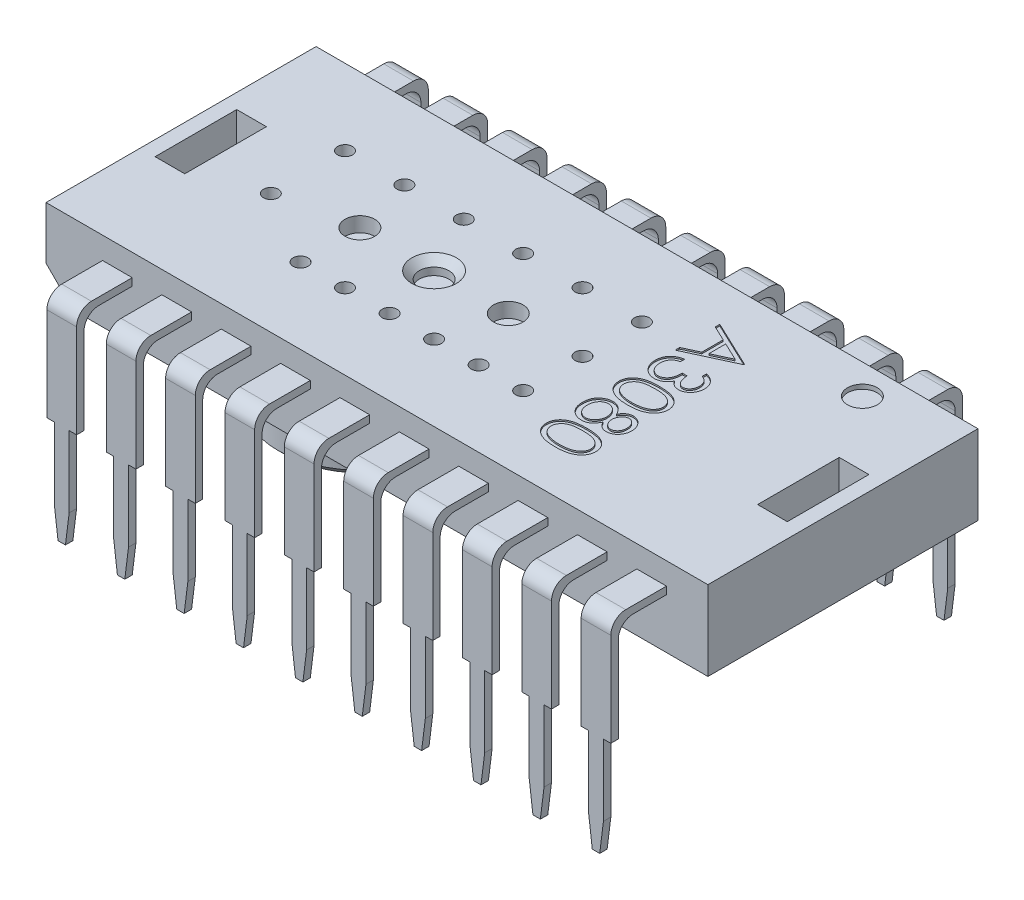
from build123d import *

# Parameters (mm, degrees)
SKETCH1_W           = 22.3
SKETCH1_H           = 9.1
BOSS_EXTRUDE1_DEPTH = 3.18
SKETCH2_R           = 2.8
SKETCH2_R_2         = 0.525
BOSS_EXTRUDE2_DEPTH = 2.25
BOSS_EXTRUDE2_DRAFT = 1.5
CHAMFER1_SIZE       = 0.3
CHAMFER1_SIZE2      = 0.308172622
SKETCH3_W           = 1
SKETCH3_H           = 1.875
BOSS_EXTRUDE3_DEPTH = 0.25
BOSS_EXTRUDE4_DEPTH = 0.25
BOSS_EXTRUDE5_DEPTH = 0.25
FILLET1_R           = 0.5
CUT_EXTRUDE1_DEPTH  = 27.146980705
SKETCH8_W           = 22.3
SKETCH8_H           = 9.1
SKETCH8_W_2         = 19.48
SKETCH8_H_2         = 7.28
CUT_EXTRUDE2_DEPTH  = 0.5
CHAMFER2_SIZE       = 0.91
CUT_EXTRUDE3_DEPTH  = 0.5
SKETCH11_R          = 0.5
CUT_EXTRUDE5_DEPTH  = 0.15
SKETCH13_R          = 0.5
SKETCH13_R_2        = 0.25
CUT_EXTRUDE6_DEPTH  = 0.5
CHAMFER3_SIZE       = 0.25
SKETCH14_W          = 1
SKETCH14_H          = 2.75
CUT_EXTRUDE7_DEPTH  = 1
CUT_EXTRUDE8_DEPTH  = 0.05


with BuildPart() as part:
    # Sketch1 → Boss-Extrude1 (new body)
    with BuildSketch(Plane(origin=(0, 0, 0), x_dir=(1, 0, 0), z_dir=(0, 1, 0))):
        with Locations((11.15, 4.55)):
            Rectangle(SKETCH1_W, SKETCH1_H)
    extrude(amount=BOSS_EXTRUDE1_DEPTH)


with BuildPart() as boss_extrude2_tool:
    # Sketch2 → Boss-Extrude2 (with draft: the straight prism first)
    with BuildSketch(Plane(origin=(0, 0, 0), x_dir=(-1, 0, 0), z_dir=(0, -1, 0))):
        with Locations((-6.025, 4.55)):
            Circle(SKETCH2_R)
        with Locations((-6.025, 4.55)):
            Circle(SKETCH2_R_2, mode=Mode.SUBTRACT)
    extrude(amount=BOSS_EXTRUDE2_DEPTH)
    # Boss-Extrude2: the draft: its side faces are tilted about the plane it starts from
    boss_extrude2_sides = [boss_extrude2_tool.faces().sort_by_distance(p)[0] for p in [
        (8.825, -1.125, -4.55),
        (6.55, -1.125, -4.55),
    ]]
    draft(boss_extrude2_sides, Plane(origin=(0, 0, 0), x_dir=(-1, 0, 0), z_dir=(0, -1, 0)), BOSS_EXTRUDE2_DRAFT)


with BuildPart() as part_1:
    add(part.part)

    # Boss-Extrude2: add boss_extrude2_tool
    add(boss_extrude2_tool.part)

    # Chamfer1
    chamfer1_edges = [part_1.edges().sort_by_distance(p)[0] for p in [
        (8.766081676, -2.25, -4.55),
    ]]
    chamfer1_side = [part_1.faces().sort_by_distance(p)[0] for p in [
        (8.795540838, -1.125, -4.55),
    ]]
    chamfer(chamfer1_edges, length=CHAMFER1_SIZE, length2=CHAMFER1_SIZE2, reference=chamfer1_side[0])

    # Sketch3 → Boss-Extrude3 (add)
    with BuildSketch(Plane(origin=(0, 2.19, 0), x_dir=(1, 0, 0), z_dir=(0, 1, 0))):
        with Locations((19.405, 10.0375)):
            Rectangle(SKETCH3_W, SKETCH3_H)
        with Locations((17.405, 10.0375)):
            Rectangle(SKETCH3_W, SKETCH3_H)
        with Locations((15.405, 10.0375)):
            Rectangle(SKETCH3_W, SKETCH3_H)
        with Locations((13.405, 10.0375)):
            Rectangle(SKETCH3_W, SKETCH3_H)
        with Locations((11.405, 10.0375)):
            Rectangle(SKETCH3_W, SKETCH3_H)
        with Locations((9.405, 10.0375)):
            Rectangle(SKETCH3_W, SKETCH3_H)
        with Locations((7.405, 10.0375)):
            Rectangle(SKETCH3_W, SKETCH3_H)
        with Locations((5.405, 10.0375)):
            Rectangle(SKETCH3_W, SKETCH3_H)
        with Locations((3.405, 10.0375)):
            Rectangle(SKETCH3_W, SKETCH3_H)
        with Locations((1.405, 10.0375)):
            Rectangle(SKETCH3_W, SKETCH3_H)
        with Locations((20.405, -0.9375)):
            Rectangle(SKETCH3_W, SKETCH3_H)
        with Locations((18.405, -0.9375)):
            Rectangle(SKETCH3_W, SKETCH3_H)
        with Locations((16.405, -0.9375)):
            Rectangle(SKETCH3_W, SKETCH3_H)
        with Locations((14.405, -0.9375)):
            Rectangle(SKETCH3_W, SKETCH3_H)
        with Locations((12.405, -0.9375)):
            Rectangle(SKETCH3_W, SKETCH3_H)
        with Locations((10.405, -0.9375)):
            Rectangle(SKETCH3_W, SKETCH3_H)
        with Locations((8.405, -0.9375)):
            Rectangle(SKETCH3_W, SKETCH3_H)
        with Locations((6.405, -0.9375)):
            Rectangle(SKETCH3_W, SKETCH3_H)
        with Locations((4.405, -0.9375)):
            Rectangle(SKETCH3_W, SKETCH3_H)
        with Locations((2.405, -0.9375)):
            Rectangle(SKETCH3_W, SKETCH3_H)
    extrude(amount=BOSS_EXTRUDE3_DEPTH)

    # Sketch5 → Boss-Extrude4 (add)
    with BuildSketch(Plane.XY.offset(1.875)):
        Polygon((1.905, 2.19), (2.905, 2.19), (2.905, -1.21), (2.655, -1.21), (2.655, -4.61), (2.155, -4.61), (2.155, -1.21), (1.905, -1.21), align=None)
        Polygon((3.905, 2.19), (4.905, 2.19), (4.905, -1.21), (4.655, -1.21), (4.655, -4.61), (4.155, -4.61), (4.155, -1.21), (3.905, -1.21), align=None)
        Polygon((5.905, 2.19), (6.905, 2.19), (6.905, -1.21), (6.655, -1.21), (6.655, -4.61), (6.155, -4.61), (6.155, -1.21), (5.905, -1.21), align=None)
        Polygon((7.905, 2.19), (8.905, 2.19), (8.905, -1.21), (8.655, -1.21), (8.655, -4.61), (8.155, -4.61), (8.155, -1.21), (7.905, -1.21), align=None)
        Polygon((9.905, 2.19), (10.905, 2.19), (10.905, -1.21), (10.655, -1.21), (10.655, -4.61), (10.155, -4.61), (10.155, -1.21), (9.905, -1.21), align=None)
        Polygon((11.905, 2.19), (12.905, 2.19), (12.905, -1.21), (12.655, -1.21), (12.655, -4.61), (12.155, -4.61), (12.155, -1.21), (11.905, -1.21), align=None)
        Polygon((13.905, 2.19), (14.905, 2.19), (14.905, -1.21), (14.655, -1.21), (14.655, -4.61), (14.155, -4.61), (14.155, -1.21), (13.905, -1.21), align=None)
        Polygon((15.905, 2.19), (16.905, 2.19), (16.905, -1.21), (16.655, -1.21), (16.655, -4.61), (16.155, -4.61), (16.155, -1.21), (15.905, -1.21), align=None)
        Polygon((17.905, 2.19), (18.905, 2.19), (18.905, -1.21), (18.655, -1.21), (18.655, -4.61), (18.155, -4.61), (18.155, -1.21), (17.905, -1.21), align=None)
        Polygon((19.905, 2.19), (20.905, 2.19), (20.905, -1.21), (20.655, -1.21), (20.655, -4.61), (20.155, -4.61), (20.155, -1.21), (19.905, -1.21), align=None)
    extrude(amount=-BOSS_EXTRUDE4_DEPTH)

    # Sketch6 → Boss-Extrude5 (add)
    with BuildSketch(Plane(origin=(0, 0, -10.975), x_dir=(-1, 0, 0), z_dir=(0, 0, -1))):
        Polygon((-19.905, 2.19), (-19.905, -1.21), (-19.655, -1.21), (-19.655, -4.61), (-19.155, -4.61), (-19.155, -1.21), (-18.905, -1.21), (-18.905, 2.19), align=None)
        Polygon((-17.905, 2.19), (-17.905, -1.21), (-17.655, -1.21), (-17.655, -4.61), (-17.155, -4.61), (-17.155, -1.21), (-16.905, -1.21), (-16.905, 2.19), align=None)
        Polygon((-15.905, 2.19), (-15.905, -1.21), (-15.655, -1.21), (-15.655, -4.61), (-15.155, -4.61), (-15.155, -1.21), (-14.905, -1.21), (-14.905, 2.19), align=None)
        Polygon((-13.905, 2.19), (-13.905, -1.21), (-13.655, -1.21), (-13.655, -4.61), (-13.155, -4.61), (-13.155, -1.21), (-12.905, -1.21), (-12.905, 2.19), align=None)
        Polygon((-11.905, 2.19), (-11.905, -1.21), (-11.655, -1.21), (-11.655, -4.61), (-11.155, -4.61), (-11.155, -1.21), (-10.905, -1.21), (-10.905, 2.19), align=None)
        Polygon((-9.905, 2.19), (-9.905, -1.21), (-9.655, -1.21), (-9.655, -4.61), (-9.155, -4.61), (-9.155, -1.21), (-8.905, -1.21), (-8.905, 2.19), align=None)
        Polygon((-7.905, 2.19), (-7.905, -1.21), (-7.655, -1.21), (-7.655, -4.61), (-7.155, -4.61), (-7.155, -1.21), (-6.905, -1.21), (-6.905, 2.19), align=None)
        Polygon((-5.905, 2.19), (-5.905, -1.21), (-5.655, -1.21), (-5.655, -4.61), (-5.155, -4.61), (-5.155, -1.21), (-4.905, -1.21), (-4.905, 2.19), align=None)
        Polygon((-3.905, 2.19), (-3.905, -1.21), (-3.655, -1.21), (-3.655, -4.61), (-3.155, -4.61), (-3.155, -1.21), (-2.905, -1.21), (-2.905, 2.19), align=None)
        Polygon((-1.905, 2.19), (-1.905, -1.21), (-1.655, -1.21), (-1.655, -4.61), (-1.155, -4.61), (-1.155, -1.21), (-0.905, -1.21), (-0.905, 2.19), align=None)
    extrude(amount=-BOSS_EXTRUDE5_DEPTH)

    # Fillet1
    fillet1_edges = [part_1.edges().sort_by_distance(p)[0] for p in [
        (7.405, 2.44, -10.975),
        (5.405, 2.44, -10.975),
        (3.405, 2.44, -10.975),
        (1.405, 2.44, -10.975),
        (18.405, 2.44, 1.875),
        (16.405, 2.44, 1.875),
        (14.405, 2.44, 1.875),
        (12.405, 2.44, 1.875),
        (10.405, 2.44, 1.875),
        (8.405, 2.44, 1.875),
        (6.405, 2.44, 1.875),
        (4.405, 2.44, 1.875),
        (2.405, 2.44, 1.875),
        (2.405, 2.19, 1.625),
        (4.405, 2.19, 1.625),
        (6.405, 2.19, 1.625),
        (19.405, 2.44, -10.975),
        (8.405, 2.19, 1.625),
        (10.405, 2.19, 1.625),
        (12.405, 2.19, 1.625),
        (14.405, 2.19, 1.625),
        (16.405, 2.19, 1.625),
        (18.405, 2.19, 1.625),
        (20.405, 2.44, 1.875),
        (20.405, 2.19, 1.625),
        (19.405, 2.19, -10.725),
        (17.405, 2.19, -10.725),
        (17.405, 2.44, -10.975),
        (15.405, 2.19, -10.725),
        (13.405, 2.19, -10.725),
        (11.405, 2.19, -10.725),
        (9.405, 2.19, -10.725),
        (7.405, 2.19, -10.725),
        (5.405, 2.19, -10.725),
        (15.405, 2.44, -10.975),
        (3.405, 2.19, -10.725),
        (1.405, 2.19, -10.725),
        (13.405, 2.44, -10.975),
        (11.405, 2.44, -10.975),
        (9.405, 2.44, -10.975),
    ]]
    fillet(fillet1_edges, radius=FILLET1_R)

    # Sketch7 → Cut-Extrude1 (cut, through all)
    with BuildSketch(Plane.XY.offset(-10.975)):
        Polygon((1.53, -4.61), (1.655, -3.61), (1.655, -4.61), align=None)
        Polygon((1.28, -4.61), (1.155, -3.61), (1.155, -4.61), align=None)
        Polygon((2.53, -4.61), (2.655, -3.61), (2.655, -4.61), align=None)
        Polygon((2.28, -4.61), (2.155, -3.61), (2.155, -4.61), align=None)
        Polygon((3.53, -4.61), (3.655, -3.61), (3.655, -4.61), align=None)
        Polygon((3.28, -4.61), (3.155, -3.61), (3.155, -4.61), align=None)
        Polygon((4.53, -4.61), (4.655, -3.61), (4.655, -4.61), align=None)
        Polygon((4.28, -4.61), (4.155, -3.61), (4.155, -4.61), align=None)
        Polygon((5.53, -4.61), (5.655, -3.61), (5.655, -4.61), align=None)
        Polygon((5.28, -4.61), (5.155, -3.61), (5.155, -4.61), align=None)
        Polygon((6.53, -4.61), (6.655, -3.61), (6.655, -4.61), align=None)
        Polygon((6.28, -4.61), (6.155, -3.61), (6.155, -4.61), align=None)
        Polygon((7.53, -4.61), (7.655, -3.61), (7.655, -4.61), align=None)
        Polygon((7.28, -4.61), (7.155, -3.61), (7.155, -4.61), align=None)
        Polygon((8.53, -4.61), (8.655, -3.61), (8.655, -4.61), align=None)
        Polygon((8.28, -4.61), (8.155, -3.61), (8.155, -4.61), align=None)
        Polygon((9.53, -4.61), (9.655, -3.61), (9.655, -4.61), align=None)
        Polygon((9.28, -4.61), (9.155, -3.61), (9.155, -4.61), align=None)
        Polygon((10.53, -4.61), (10.655, -3.61), (10.655, -4.61), align=None)
        Polygon((10.28, -4.61), (10.155, -3.61), (10.155, -4.61), align=None)
        Polygon((11.53, -4.61), (11.655, -3.61), (11.655, -4.61), align=None)
        Polygon((11.28, -4.61), (11.155, -3.61), (11.155, -4.61), align=None)
        Polygon((12.53, -4.61), (12.655, -3.61), (12.655, -4.61), align=None)
        Polygon((12.28, -4.61), (12.155, -3.61), (12.155, -4.61), align=None)
        Polygon((13.53, -4.61), (13.655, -3.61), (13.655, -4.61), align=None)
        Polygon((13.28, -4.61), (13.155, -3.61), (13.155, -4.61), align=None)
        Polygon((14.53, -4.61), (14.655, -3.61), (14.655, -4.61), align=None)
        Polygon((14.28, -4.61), (14.155, -3.61), (14.155, -4.61), align=None)
        Polygon((15.53, -4.61), (15.655, -3.61), (15.655, -4.61), align=None)
        Polygon((15.28, -4.61), (15.155, -3.61), (15.155, -4.61), align=None)
        Polygon((16.53, -4.61), (16.655, -3.61), (16.655, -4.61), align=None)
        Polygon((16.28, -4.61), (16.155, -3.61), (16.155, -4.61), align=None)
        Polygon((17.53, -4.61), (17.655, -3.61), (17.655, -4.61), align=None)
        Polygon((17.28, -4.61), (17.155, -3.61), (17.155, -4.61), align=None)
        Polygon((18.53, -4.61), (18.655, -3.61), (18.655, -4.61), align=None)
        Polygon((18.28, -4.61), (18.155, -3.61), (18.155, -4.61), align=None)
        Polygon((19.53, -4.61), (19.655, -3.61), (19.655, -4.61), align=None)
        Polygon((19.28, -4.61), (19.155, -3.61), (19.155, -4.61), align=None)
        Polygon((20.53, -4.61), (20.655, -3.61), (20.655, -4.61), align=None)
        Polygon((20.28, -4.61), (20.155, -3.61), (20.155, -4.61), align=None)
    extrude(amount=CUT_EXTRUDE1_DEPTH, mode=Mode.SUBTRACT)

    # Sketch8 → Cut-Extrude2 (cut)
    with BuildSketch(Plane(origin=(0, 0, 0), x_dir=(-1, 0, 0), z_dir=(0, -1, 0))):
        with Locations((-11.15, 4.55)):
            Rectangle(SKETCH8_W, SKETCH8_H)
        with Locations((-11.15, 4.55)):
            Rectangle(SKETCH8_W_2, SKETCH8_H_2, mode=Mode.SUBTRACT)
    extrude(amount=-CUT_EXTRUDE2_DEPTH, mode=Mode.SUBTRACT)

    # Chamfer2
    chamfer2_edges = [part_1.edges().sort_by_distance(p)[0] for p in [
        (0, 0.5, -4.55),
    ]]
    chamfer(chamfer2_edges, length=CHAMFER2_SIZE)

    # Sketch9 → Cut-Extrude3 (cut)
    with BuildSketch(Plane(origin=(0, 0, 0), x_dir=(-1, 0, 0), z_dir=(0, -1, 0))):
        with BuildLine():
            Line((-1.41, 3.05), (-1.41, 6.05))
            ThreePointArc((-1.41, 6.05), (-2.117106781, 5.757106781), (-2.41, 5.05))
            Line((-2.41, 5.05), (-2.41, 4.05))
            ThreePointArc((-2.41, 4.05), (-2.117106781, 3.342893219), (-1.41, 3.05))
        make_face()
    extrude(amount=-CUT_EXTRUDE3_DEPTH, mode=Mode.SUBTRACT)

    # Sketch11 → Cut-Extrude5 (cut)
    with BuildSketch(Plane(origin=(0, 3.18, 0), x_dir=(1, 0, 0), z_dir=(0, 1, 0))):
        with Locations(Location((19.405, 8.1, 0), (0, 0, 270))):
            Circle(SKETCH11_R)
    extrude(amount=-CUT_EXTRUDE5_DEPTH, mode=Mode.SUBTRACT)

    # Sketch13 → Cut-Extrude6 (cut)
    with BuildSketch(Plane(origin=(0, 3.18, 0), x_dir=(1, 0, 0), z_dir=(0, 1, 0))):
        with Locations(Location((6.025, 4.55, 0), (0, 0, 270))):
            Circle(SKETCH13_R)
        with Locations(Location((8.525, 4.55, 0), (0, 0, 270))):
            Circle(SKETCH13_R)
        with Locations(Location((11.025, 4.55, 0), (0, 0, 270))):
            Circle(SKETCH13_R)
        with Locations(Location((3.525, 6.55, 0), (0, 0, 270))):
            Circle(SKETCH13_R_2)
        with Locations(Location((5.525, 6.55, 0), (0, 0, 270))):
            Circle(SKETCH13_R_2)
        with Locations(Location((7.525, 6.55, 0), (0, 0, 270))):
            Circle(SKETCH13_R_2)
        with Locations(Location((9.525, 6.55, 0), (0, 0, 270))):
            Circle(SKETCH13_R_2)
        with Locations(Location((11.525, 6.55, 0), (0, 0, 270))):
            Circle(SKETCH13_R_2)
        with Locations(Location((13.525, 6.55, 0), (0, 0, 270))):
            Circle(SKETCH13_R_2)
        with Locations(Location((13.525, 4.55, 0), (0, 0, 270))):
            Circle(SKETCH13_R_2)
        with Locations(Location((13.525, 2.55, 0), (0, 0, 270))):
            Circle(SKETCH13_R_2)
        with Locations(Location((12.025, 2.55, 0), (0, 0, 270))):
            Circle(SKETCH13_R_2)
        with Locations(Location((10.525, 2.55, 0), (0, 0, 270))):
            Circle(SKETCH13_R_2)
        with Locations(Location((9.025, 2.55, 0), (0, 0, 270))):
            Circle(SKETCH13_R_2)
        with Locations(Location((7.525, 2.55, 0), (0, 0, 270))):
            Circle(SKETCH13_R_2)
        with Locations(Location((6.025, 2.55, 0), (0, 0, 270))):
            Circle(SKETCH13_R_2)
        with Locations(Location((3.525, 4.05, 0), (0, 0, 270))):
            Circle(SKETCH13_R_2)
    extrude(amount=-CUT_EXTRUDE6_DEPTH, mode=Mode.SUBTRACT)

    # Chamfer3
    chamfer3_edges = [part_1.edges().sort_by_distance(p)[0] for p in [
        (8.525, 3.18, -5.05),
    ]]
    chamfer(chamfer3_edges, length=CHAMFER3_SIZE)

    # Sketch14 → Cut-Extrude7 (cut)
    with BuildSketch(Plane(origin=(0, 3.18, 0), x_dir=(1, 0, 0), z_dir=(0, 1, 0))):
        with Locations((1, 4.55)):
            Rectangle(SKETCH14_W, SKETCH14_H)
        with Locations((21.3, 4.55)):
            Rectangle(SKETCH14_W, SKETCH14_H)
    extrude(amount=-CUT_EXTRUDE7_DEPTH, mode=Mode.SUBTRACT)

    # Sketch15 → Cut-Extrude8 (cut)
    # profile 1 of 5: a face of its own
    with BuildSketch(Plane(origin=(0, 3.18, 0), x_dir=(1, 0, 0), z_dir=(0, 1, 0))):
        Polygon((16.4925, 7.024038462), (14.905, 6.291346154), (14.905, 6.446216446), (15.413814103, 6.680906951), (15.413814103, 7.400560897), (14.905, 7.641929587), (14.905, 7.797435897), (16.4925, 7.044391026), align=None)
        Polygon((16.183077424, 7.035804788), (15.576634615, 7.323284756), (15.576634615, 6.755957031), align=None, mode=Mode.SUBTRACT)
    # profile 2 of 5: a face of its own
    with BuildSketch(Plane(origin=(0, 3.18, 0), x_dir=(1, 0, 0), z_dir=(0, 1, 0))):
        with BuildLine():
            Line((16.126153846, 5.986057692), (16.126153846, 6.128525641))
            add(Edge.make_bspline(
                [(16.126153846, 6.128525641), (16.142134294, 6.124665952), (16.173374763, 6.117120576), (16.218009485, 6.101382748), (16.260247654, 6.084238085), (16.299298373, 6.063650884), (16.335946447, 6.041195128), (16.369360657, 6.015467322), (16.400390823, 5.987654448), (16.427928613, 5.956890989), (16.45286494, 5.92462906), (16.474126127, 5.890414072), (16.49241601, 5.854934402), (16.507483759, 5.817944231), (16.518834621, 5.779333432), (16.527070029, 5.739451067), (16.532418142, 5.698192622), (16.532940095, 5.67018568), (16.533205128, 5.655964543)],
                knots=[0, 0, 0, 0, 1.162005537, 2.271625781, 3.343758855, 4.383309926, 5.390229558, 6.379919256, 7.361854164, 8.333198761, 9.295911338, 10.242430842, 11.177959212, 12.116337295, 13.062827104, 14.020064771, 14.994644689, 16, 16, 16, 16], degree=3))
            add(Edge.make_bspline(
                [(16.533205128, 5.655964543), (16.532579549, 5.635244157), (16.531342036, 5.594255355), (16.520041559, 5.53403783), (16.502159445, 5.475968523), (16.477451719, 5.420683043), (16.446977474, 5.369330397), (16.410707754, 5.323639341), (16.369342356, 5.284229195), (16.323652943, 5.251166388), (16.27482348, 5.225278799), (16.224567694, 5.206189622), (16.1730048, 5.19456836), (16.138189891, 5.19306225), (16.120747696, 5.192307692)],
                knots=[0, 0, 0, 0, 1.083050992, 2.142477498, 3.193116406, 4.255571735, 5.30263384, 6.308962982, 7.297363603, 8.282367274, 9.249857812, 10.179914175, 11.08814088, 12, 12, 12, 12], degree=3))
            add(Edge.make_bspline(
                [(16.120747696, 5.192307692), (16.103962472, 5.192835464), (16.071116392, 5.193868231), (16.023164141, 5.202637448), (15.977969558, 5.217394967), (15.935342388, 5.237837323), (15.895552907, 5.264299384), (15.858511592, 5.2963545), (15.824054153, 5.334228921), (15.804314963, 5.36293044), (15.794152644, 5.377706831)],
                knots=[0, 0, 0, 0, 1.024540389, 2.004866551, 2.965041327, 3.920577974, 4.882998113, 5.874504559, 6.905732034, 8, 8, 8, 8], degree=3))
            add(Edge.make_bspline(
                [(15.794152644, 5.377706831), (15.785998259, 5.360819571), (15.769842064, 5.327361024), (15.738157488, 5.281754177), (15.701574074, 5.240353141), (15.673025085, 5.217264668), (15.658680889, 5.205664062)],
                knots=[0, 0, 0, 0, 1.015518401, 2.012035669, 3.001164323, 4, 4, 4, 4], degree=3))
            add(Edge.make_bspline(
                [(15.658680889, 5.205664062), (15.648223667, 5.198022201), (15.627480465, 5.18286362), (15.594110161, 5.164205787), (15.560480456, 5.147085967), (15.525269074, 5.134486276), (15.489607067, 5.123613241), (15.452730768, 5.116459146), (15.414990535, 5.111866504), (15.389446887, 5.111221603), (15.376607071, 5.110897436)],
                knots=[0, 0, 0, 0, 1.02516404, 2.033540309, 3.025129118, 4.011046665, 4.991655828, 5.976607087, 6.982917762, 8, 8, 8, 8], degree=3))
            add(Edge.make_bspline(
                [(15.376607071, 5.110897436), (15.354378546, 5.111713168), (15.310026103, 5.113340794), (15.244483238, 5.127830044), (15.180524796, 5.150421867), (15.119098432, 5.181943207), (15.061745877, 5.220943386), (15.010663742, 5.267599106), (14.966459163, 5.320776176), (14.929644291, 5.380126562), (14.900193981, 5.444399758), (14.87975868, 5.513151651), (14.866447773, 5.585382508), (14.865020499, 5.634915875), (14.864294872, 5.660098658)],
                knots=[0, 0, 0, 0, 0.95570045, 1.906903359, 2.87519758, 3.868912786, 4.869932978, 5.851730567, 6.836639976, 7.83677598, 8.849487602, 9.869908895, 10.917060885, 12, 12, 12, 12], degree=3))
            add(Edge.make_bspline(
                [(14.864294872, 5.660098658), (14.864688669, 5.677070983), (14.865463529, 5.71046686), (14.870760609, 5.759563018), (14.88043529, 5.806426789), (14.893454289, 5.851121535), (14.909960544, 5.893686963), (14.93051581, 5.933993182), (14.954696384, 5.972288169), (14.98278769, 6.008210551), (15.014211726, 6.041756044), (15.049526349, 6.072033172), (15.088078743, 6.099546721), (15.1303167, 6.12355999), (15.175694371, 6.14516675), (15.224792797, 6.162938113), (15.27717305, 6.178579781), (15.313675453, 6.185852103), (15.332403846, 6.189583333)],
                knots=[0, 0, 0, 0, 1.048658725, 2.063410685, 3.046034179, 4.001477787, 4.936774919, 5.862367409, 6.792675028, 7.730719943, 8.675894397, 9.627829632, 10.600096036, 11.597688215, 12.626045268, 13.701542398, 14.82072376, 16, 16, 16, 16], degree=3))
            Line((15.332403846, 6.189583333), (15.332403846, 6.047115385))
            add(Edge.make_bspline(
                [(15.332403846, 6.047115385), (15.320180544, 6.043403677), (15.296405159, 6.036184085), (15.262187592, 6.023894885), (15.230819475, 6.009893919), (15.202070701, 5.994874101), (15.175658147, 5.979099592), (15.152280228, 5.961448894), (15.130910119, 5.943229317), (15.118870241, 5.929495467), (15.112977764, 5.922773938)],
                knots=[0, 0, 0, 0, 1.198163088, 2.33053128, 3.407730985, 4.417276592, 5.372219308, 6.28897303, 7.162600585, 8, 8, 8, 8], degree=3))
            add(Edge.make_bspline(
                [(15.112977764, 5.922773938), (15.106125056, 5.913885491), (15.092440791, 5.896136033), (15.074977553, 5.867212586), (15.059845945, 5.836793869), (15.048287269, 5.804220785), (15.038500258, 5.770196228), (15.032095594, 5.734170245), (15.027701316, 5.696460671), (15.027313544, 5.670712436), (15.027115385, 5.657554587)],
                knots=[0, 0, 0, 0, 0.946170439, 1.889420265, 2.845303464, 3.807233317, 4.801018734, 5.828864929, 6.890507805, 8, 8, 8, 8], degree=3))
            add(Edge.make_bspline(
                [(15.027115385, 5.657554587), (15.027394287, 5.642698333), (15.027939657, 5.613648211), (15.032969629, 5.571262566), (15.040263244, 5.53092665), (15.051671877, 5.493052089), (15.065358417, 5.457123504), (15.083276609, 5.423942925), (15.10351231, 5.392534884), (15.127050322, 5.36381949), (15.152492366, 5.337931159), (15.179484107, 5.315560781), (15.207188626, 5.296185475), (15.236252213, 5.280610962), (15.266389777, 5.268290792), (15.297714125, 5.259908797), (15.329961484, 5.254079329), (15.351882168, 5.253604668), (15.362932692, 5.253365385)],
                knots=[0, 0, 0, 0, 1.216990249, 2.379719373, 3.493992396, 4.571561497, 5.616923107, 6.638958652, 7.655775068, 8.674704564, 9.676001865, 10.625896028, 11.54399481, 12.441854662, 13.322657739, 14.20572845, 15.095482574, 16, 16, 16, 16], degree=3))
            add(Edge.make_bspline(
                [(15.362932692, 5.253365385), (15.377724281, 5.254059473), (15.407233856, 5.255444197), (15.450648363, 5.266016487), (15.492479244, 5.283405181), (15.532006794, 5.307752319), (15.568659066, 5.337375952), (15.601233951, 5.371989323), (15.62838324, 5.411677338), (15.647071792, 5.448440517), (15.659526925, 5.481082693), (15.668260232, 5.508961706), (15.675241483, 5.54020072), (15.681994455, 5.574424717), (15.687655718, 5.611778038), (15.692397247, 5.652294335), (15.696185256, 5.695989908), (15.697877803, 5.726239054), (15.69875, 5.741826923)],
                knots=[0, 0, 0, 0, 1.070481957, 2.135637345, 3.216366529, 4.339485895, 5.485746587, 6.620975969, 7.768829582, 8.956804399, 9.598399438, 10.297751078, 11.070570279, 11.915248466, 12.824061284, 13.805856426, 14.869322739, 16, 16, 16, 16], degree=3))
            Line((15.69875, 5.741826923), (15.861570513, 5.741826923))
            add(Edge.make_bspline(
                [(15.861570513, 5.741826923), (15.861905252, 5.722187294), (15.862560924, 5.683718086), (15.870436244, 5.627515528), (15.88145278, 5.573708221), (15.897937562, 5.523524379), (15.917724005, 5.477932735), (15.940034664, 5.438161166), (15.965311641, 5.405152242), (15.993223197, 5.378823493), (16.023508241, 5.359499126), (16.054742756, 5.344994274), (16.087653465, 5.336490943), (16.110100708, 5.335349421), (16.121383714, 5.334775641)],
                knots=[0, 0, 0, 0, 1.321708579, 2.588902423, 3.815526512, 5.016621128, 6.138757764, 7.158873101, 8.079948563, 8.928590313, 9.728601868, 10.489025425, 11.240515403, 12, 12, 12, 12], degree=3))
            add(Edge.make_bspline(
                [(16.121383714, 5.334775641), (16.129673997, 5.334963584), (16.146167122, 5.335337488), (16.170262842, 5.340053717), (16.193623292, 5.347139137), (16.216142474, 5.35688632), (16.237689676, 5.369908975), (16.258291334, 5.385540498), (16.278292709, 5.403788435), (16.296736911, 5.425129696), (16.314134517, 5.448233886), (16.3291741, 5.473318402), (16.341921641, 5.499829975), (16.352453827, 5.527792983), (16.360371479, 5.557319446), (16.366057766, 5.588264786), (16.369612594, 5.620689634), (16.370124426, 5.642811087), (16.370384615, 5.65405649)],
                knots=[0, 0, 0, 0, 0.884317272, 1.759307272, 2.611736065, 3.488921043, 4.37244062, 5.294096728, 6.247679003, 7.258495569, 8.302441962, 9.333537773, 10.376747089, 11.440883505, 12.520330301, 13.637364711, 14.798958396, 16, 16, 16, 16], degree=3))
            add(Edge.make_bspline(
                [(16.370384615, 5.65405649), (16.369754757, 5.672132666), (16.368524498, 5.70743964), (16.357711076, 5.758328798), (16.340578323, 5.805588323), (16.319890575, 5.841590547), (16.299539373, 5.868220971), (16.282031234, 5.887615672), (16.26218059, 5.906314151), (16.23944296, 5.923582662), (16.214600201, 5.940455971), (16.187515486, 5.956772963), (16.157802669, 5.972009536), (16.13690776, 5.981284287), (16.126153846, 5.986057692)],
                knots=[0, 0, 0, 0, 1.4727372, 2.876598283, 4.222346151, 5.558423782, 6.24313385, 6.953189256, 7.68715613, 8.463578749, 9.278833271, 10.135787152, 11.040551781, 12, 12, 12, 12], degree=3))
        make_face()
    # profile 3 of 5: a face of its own
    with BuildSketch(Plane(origin=(0, 3.18, 0), x_dir=(1, 0, 0), z_dir=(0, 1, 0))):
        with BuildLine():
            add(Edge.make_bspline(
                [(15.698113982, 4.968429487), (15.723558155, 4.968280708), (15.772983826, 4.967991701), (15.845004003, 4.964776596), (15.912568134, 4.959435637), (15.975679453, 4.952116185), (16.034354256, 4.943208962), (16.088435724, 4.931318353), (16.138174228, 4.917796161), (16.183731737, 4.902124012), (16.225722802, 4.884440772), (16.264921166, 4.865192013), (16.301277064, 4.843624331), (16.335336659, 4.820933531), (16.366719828, 4.79629043), (16.39536714, 4.769954953), (16.421295893, 4.741665862), (16.444814682, 4.711982651), (16.465302546, 4.68071773), (16.483763473, 4.648834892), (16.498915485, 4.61577154), (16.511365576, 4.581829221), (16.521341519, 4.547106644), (16.52824984, 4.511460336), (16.5325795, 4.474881687), (16.532994607, 4.450193421), (16.533205128, 4.437672776)],
                knots=[0, 0, 0, 0, 1.646377244, 3.198111528, 4.663803227, 6.031090796, 7.308794487, 8.502186765, 9.612154809, 10.642545331, 11.617106989, 12.558866172, 13.465886467, 14.35053239, 15.20542558, 16.045215227, 16.865619885, 17.686225247, 18.492864914, 19.282407821, 20.068097601, 20.842842034, 21.620163247, 22.403093475, 23.190129512, 24, 24, 24, 24], degree=3))
            add(Edge.make_bspline(
                [(16.533205128, 4.437672776), (16.532983869, 4.425047399), (16.532543855, 4.399939495), (16.528314781, 4.362819039), (16.521297521, 4.326556147), (16.511354793, 4.29130542), (16.499019612, 4.256777301), (16.483558669, 4.223241859), (16.465561469, 4.19049079), (16.44441421, 4.159044553), (16.420836535, 4.128557923), (16.394183467, 4.09977974), (16.36472413, 4.072707383), (16.332773713, 4.047001084), (16.297719407, 4.023390153), (16.2601709, 4.00090506), (16.219471543, 3.980779172), (16.176300403, 3.961395945), (16.129462957, 3.944665062), (16.079223227, 3.929576443), (16.024987792, 3.917384911), (15.967041209, 3.907229777), (15.905170672, 3.899362627), (15.839508808, 3.893632822), (15.770012416, 3.890606101), (15.722497249, 3.890036097), (15.698113982, 3.88974359)],
                knots=[0, 0, 0, 0, 0.810914788, 1.612654377, 2.396697861, 3.181598691, 3.963628158, 4.749916497, 5.551656086, 6.361998678, 7.18212741, 8.025565596, 8.878627764, 9.750805457, 10.657531673, 11.591944965, 12.560506719, 13.57287815, 14.630710178, 15.753379473, 16.941251878, 18.199788006, 19.531962791, 20.947069417, 22.433333509, 24, 24, 24, 24], degree=3))
            add(Edge.make_bspline(
                [(15.698113982, 3.88974359), (15.673837158, 3.890039495), (15.626534755, 3.890616055), (15.557349809, 3.893594922), (15.492040816, 3.899490316), (15.430425983, 3.906781989), (15.372871135, 3.917168876), (15.318828997, 3.928976937), (15.268765942, 3.943653088), (15.222175513, 3.960155929), (15.179215883, 3.97911856), (15.138868353, 3.999422323), (15.101350485, 4.021769397), (15.066296688, 4.045521139), (15.034069178, 4.071008938), (15.004588306, 4.09819593), (14.977873516, 4.12710281), (14.953973696, 4.157658366), (14.933072606, 4.189599297), (14.914390394, 4.222241047), (14.899230937, 4.256235116), (14.886431514, 4.290826014), (14.876465912, 4.326340127), (14.869642532, 4.362742622), (14.864843773, 4.399914282), (14.864478472, 4.425043031), (14.864294872, 4.437672776)],
                knots=[0, 0, 0, 0, 1.56130642, 3.042141888, 4.451772327, 5.777565838, 7.030558081, 8.211376819, 9.333164717, 10.383253789, 11.387583522, 12.350962576, 13.286244149, 14.193812918, 15.072134482, 15.925989337, 16.770211267, 17.600669898, 18.417446232, 19.22325363, 20.01647746, 20.807971184, 21.593601364, 22.38506573, 23.188331689, 24, 24, 24, 24], degree=3))
            add(Edge.make_bspline(
                [(14.864294872, 4.437672776), (14.864507419, 4.450192912), (14.864926521, 4.474880175), (14.86922692, 4.511466172), (14.876239421, 4.547056885), (14.885762363, 4.581723464), (14.897865458, 4.615536855), (14.913260146, 4.648165822), (14.93111559, 4.680041282), (14.951429498, 4.711017785), (14.974708708, 4.740504939), (15.000454823, 4.768671687), (15.029313608, 4.79480683), (15.060823134, 4.819141074), (15.094716042, 4.84223295), (15.131326202, 4.863589285), (15.170891832, 4.882800498), (15.213114701, 4.900880034), (15.259007035, 4.91681711), (15.309010824, 4.930788456), (15.363402678, 4.942435527), (15.422021124, 4.951802162), (15.484910036, 4.95952401), (15.552180141, 4.964751305), (15.6237734, 4.967994261), (15.672881592, 4.968281765), (15.698113982, 4.968429487)],
                knots=[0, 0, 0, 0, 0.810940842, 1.599017053, 2.38298203, 3.159479784, 3.926441347, 4.70693857, 5.494146311, 6.292334103, 7.104379492, 7.925868426, 8.762126819, 9.623561095, 10.503686106, 11.41783325, 12.366995289, 13.351843594, 14.392337808, 15.512229747, 16.713911458, 17.994391108, 19.357476964, 20.818259213, 22.365182633, 24, 24, 24, 24], degree=3))
        make_face()
        with BuildLine():
            add(Edge.make_bspline(
                [(15.69875, 4.825961538), (15.677546126, 4.825907361), (15.63639357, 4.825802212), (15.576593234, 4.823055293), (15.520817406, 4.819313223), (15.468995267, 4.814486634), (15.421302222, 4.807318872), (15.377410271, 4.799287565), (15.337551626, 4.789514014), (15.301453006, 4.777950049), (15.268500996, 4.764779266), (15.237840651, 4.750396571), (15.209100239, 4.734954044), (15.182571667, 4.717641334), (15.157990864, 4.69885113), (15.135428467, 4.678552578), (15.114982921, 4.656781376), (15.090722299, 4.626642896), (15.065355633, 4.587050433), (15.043538363, 4.536909547), (15.02973887, 4.485365062), (15.027988866, 4.450369843), (15.027115385, 4.432902644)],
                knots=[0, 0, 0, 0, 1.459116078, 2.831857795, 4.118796693, 5.306371758, 6.412361096, 7.436813035, 8.376339383, 9.234574298, 10.043323891, 10.816788787, 11.564361537, 12.286735248, 12.994408768, 13.691741332, 14.372975427, 15.047457468, 16.352811911, 17.594285292, 18.799233213, 20, 20, 20, 20], degree=3))
            add(Edge.make_bspline(
                [(15.027115385, 4.432902644), (15.027840092, 4.415323272), (15.029288012, 4.380200822), (15.043257439, 4.328886564), (15.064334694, 4.279070692), (15.089257313, 4.240030919), (15.112991948, 4.210329908), (15.133227878, 4.189049702), (15.155886432, 4.169517987), (15.180333612, 4.150993189), (15.207036489, 4.134002823), (15.235866657, 4.118552756), (15.266904177, 4.104454238), (15.288571166, 4.096421921), (15.299648938, 4.092315204)],
                knots=[0, 0, 0, 0, 1.353760809, 2.704726607, 4.075137775, 5.516104923, 6.260822281, 7.007110065, 7.778089737, 8.566572457, 9.372053459, 10.217411131, 11.088608312, 12, 12, 12, 12], degree=3))
            add(Edge.make_bspline(
                [(15.299648938, 4.092315204), (15.313813856, 4.087529224), (15.342574713, 4.077811631), (15.387189655, 4.065287719), (15.43399948, 4.055424628), (15.482724444, 4.046551244), (15.53372388, 4.040494679), (15.58683999, 4.035619778), (15.642112822, 4.032748359), (15.679666264, 4.032392419), (15.69875, 4.032211538)],
                knots=[0, 0, 0, 0, 0.884706709, 1.796334032, 2.740027952, 3.714592787, 4.726048262, 5.777819803, 6.87074269, 8, 8, 8, 8], degree=3))
            add(Edge.make_bspline(
                [(15.69875, 4.032211538), (15.717833325, 4.03241103), (15.755169007, 4.032801327), (15.809791144, 4.03536561), (15.86176106, 4.0394862), (15.9111259, 4.045063329), (15.957797802, 4.052719547), (16.001843552, 4.061913903), (16.043251275, 4.07269323), (16.082127759, 4.08505744), (16.118333271, 4.098991733), (16.151946638, 4.114384949), (16.183146057, 4.130811596), (16.211841976, 4.148656741), (16.238163919, 4.167704625), (16.261583886, 4.188458982), (16.282827799, 4.210096312), (16.307076892, 4.240402682), (16.33180184, 4.280078519), (16.354555595, 4.329447795), (16.367622213, 4.380824123), (16.369464479, 4.415555654), (16.370384615, 4.432902644)],
                knots=[0, 0, 0, 0, 1.313668642, 2.570134578, 3.763346207, 4.902004944, 5.98888779, 7.017888835, 7.998425394, 8.933058446, 9.82474457, 10.667209444, 11.476765193, 12.250262638, 12.991704352, 13.7104269, 14.401925311, 15.076585796, 16.378385137, 17.609787933, 18.806186071, 20, 20, 20, 20], degree=3))
            add(Edge.make_bspline(
                [(16.370384615, 4.432902644), (16.369464396, 4.4504614), (16.367622282, 4.4856109), (16.354589859, 4.537510053), (16.332013683, 4.58723101), (16.306917226, 4.626588532), (16.283257076, 4.656856664), (16.26268212, 4.678230192), (16.240051467, 4.698212214), (16.215574733, 4.717018072), (16.189032782, 4.734314117), (16.160296549, 4.749762963), (16.129633354, 4.764137402), (16.096688842, 4.777336462), (16.060535801, 4.788793259), (16.020878318, 4.799033522), (15.976945371, 4.807059957), (15.929118989, 4.814064164), (15.877233144, 4.819404474), (15.821328727, 4.823045686), (15.761424977, 4.825807182), (15.72006009, 4.825909056), (15.69875, 4.825961538)],
                knots=[0, 0, 0, 0, 1.207964612, 2.418129846, 3.655795183, 4.951004962, 5.620895151, 6.296795572, 6.989224116, 7.696855977, 8.419187164, 9.166715907, 9.940135271, 10.748837255, 11.607021648, 12.548275234, 13.5654991, 14.678641405, 15.874140913, 17.15372626, 18.533675393, 20, 20, 20, 20], degree=3))
        make_face(mode=Mode.SUBTRACT)
    # profile 4 of 5: a face of its own
    with BuildSketch(Plane(origin=(0, 3.18, 0), x_dir=(1, 0, 0), z_dir=(0, 1, 0))):
        with BuildLine():
            add(Edge.make_bspline(
                [(15.789382512, 2.975468249), (15.782598799, 2.962583942), (15.769326908, 2.937376636), (15.74802559, 2.901309763), (15.725773572, 2.868103596), (15.703269362, 2.837284903), (15.679623436, 2.809482281), (15.655105697, 2.78451176), (15.630372897, 2.761589951), (15.604457283, 2.741921935), (15.577893369, 2.724578366), (15.550452814, 2.709609879), (15.522222169, 2.69681007), (15.492886301, 2.686667223), (15.46287798, 2.678311531), (15.43180923, 2.672562264), (15.39988491, 2.669470298), (15.378309286, 2.66888573), (15.367384816, 2.668589744)],
                knots=[0, 0, 0, 0, 1.264385854, 2.473688339, 3.635349404, 4.734491366, 5.785876313, 6.801388178, 7.772322209, 8.711311751, 9.622826105, 10.524996139, 11.423212571, 12.31118177, 13.217849097, 14.126010572, 15.051135535, 16, 16, 16, 16], degree=3))
            add(Edge.make_bspline(
                [(15.367384816, 2.668589744), (15.352099437, 2.668936526), (15.321843939, 2.669622937), (15.277206854, 2.675700681), (15.233752008, 2.68457102), (15.191899513, 2.698384057), (15.151124905, 2.71488287), (15.112173717, 2.736107627), (15.073956776, 2.759926428), (15.050455365, 2.779096872), (15.038563702, 2.788797075)],
                knots=[0, 0, 0, 0, 1.02534174, 2.029536028, 3.018826961, 3.997522084, 4.983122576, 5.966563916, 6.971085759, 8, 8, 8, 8], degree=3))
            add(Edge.make_bspline(
                [(15.038563702, 2.788797075), (15.02468724, 2.801422905), (14.997105792, 2.826518543), (14.96129596, 2.869509371), (14.93120177, 2.916690725), (14.906676304, 2.96788004), (14.887587361, 3.022940483), (14.873870219, 3.08186032), (14.86601326, 3.144754418), (14.864877522, 3.187982257), (14.864294872, 3.210158754)],
                knots=[0, 0, 0, 0, 0.954267603, 1.896743057, 2.838368354, 3.796610408, 4.779680527, 5.799409237, 6.871065594, 8, 8, 8, 8], degree=3))
            add(Edge.make_bspline(
                [(14.864294872, 3.210158754), (14.864819006, 3.231482193), (14.865838917, 3.272975439), (14.872711364, 3.333378808), (14.884878222, 3.389752596), (14.901186709, 3.44236407), (14.922934446, 3.490704542), (14.949590886, 3.53486173), (14.980553933, 3.575483476), (15.016569803, 3.611293073), (15.0551507, 3.643082733), (15.094952048, 3.671008359), (15.135979177, 3.694219429), (15.177619904, 3.713871369), (15.220457986, 3.728915435), (15.26427299, 3.739334973), (15.308988395, 3.745952269), (15.339165252, 3.746832713), (15.354346454, 3.747275641)],
                knots=[0, 0, 0, 0, 1.256882982, 2.445766618, 3.576898315, 4.651879663, 5.686612882, 6.692806257, 7.686348993, 8.689277895, 9.678883454, 10.630458183, 11.551151498, 12.454054546, 13.341321255, 14.221808008, 15.105437234, 16, 16, 16, 16], degree=3))
            add(Edge.make_bspline(
                [(15.354346454, 3.747275641), (15.365485811, 3.747013543), (15.38750111, 3.746495546), (15.420026291, 3.74290995), (15.451684275, 3.737146432), (15.482589298, 3.72931553), (15.512526343, 3.718715317), (15.541600017, 3.705870797), (15.570033701, 3.691038921), (15.597338586, 3.673261293), (15.624424655, 3.653688991), (15.649968913, 3.630471792), (15.675394379, 3.605007967), (15.699600897, 3.57625786), (15.723751926, 3.545101438), (15.746310533, 3.510594378), (15.768927266, 3.473706166), (15.782447107, 3.447486908), (15.789382512, 3.434036959)],
                knots=[0, 0, 0, 0, 0.941717298, 1.86116577, 2.762973304, 3.660719123, 4.553575492, 5.444450535, 6.34648071, 7.261375261, 8.197060099, 9.168336537, 10.175980388, 11.237504102, 12.343496232, 13.506792996, 14.721035322, 16, 16, 16, 16], degree=3))
            add(Edge.make_bspline(
                [(15.789382512, 3.434036959), (15.799420647, 3.452449954), (15.818857285, 3.488102666), (15.854595772, 3.535279758), (15.893161175, 3.575867978), (15.935828094, 3.608294359), (15.980717316, 3.634024959), (16.027684994, 3.65219502), (16.076168735, 3.664060294), (16.10923115, 3.665261907), (16.125835837, 3.665865385)],
                knots=[0, 0, 0, 0, 1.16709546, 2.25982348, 3.287408737, 4.277418348, 5.234967981, 6.16072867, 7.076276605, 8, 8, 8, 8], degree=3))
            add(Edge.make_bspline(
                [(16.125835837, 3.665865385), (16.142752926, 3.665123589), (16.176759225, 3.663632449), (16.22738085, 3.651575236), (16.277098684, 3.631925604), (16.325678626, 3.605204236), (16.371449837, 3.57190434), (16.412639989, 3.53196145), (16.44840944, 3.48605901), (16.478628644, 3.435012021), (16.503346086, 3.380185009), (16.52021917, 3.322237765), (16.531316909, 3.262205827), (16.532569845, 3.221339295), (16.533205128, 3.20061849)],
                knots=[0, 0, 0, 0, 0.888753872, 1.786550278, 2.720173491, 3.693036334, 4.694165094, 5.687489879, 6.699912706, 7.744713188, 8.800178723, 9.852977058, 10.911381959, 12, 12, 12, 12], degree=3))
            add(Edge.make_bspline(
                [(16.533205128, 3.20061849), (16.532551918, 3.180432103), (16.531263862, 3.140626848), (16.520415787, 3.08202939), (16.50249893, 3.025916366), (16.478102907, 2.972593967), (16.447680334, 2.923227274), (16.411550033, 2.879150458), (16.370504612, 2.840486873), (16.324857361, 2.808363271), (16.276278598, 2.782439243), (16.225755792, 2.763977374), (16.173965963, 2.752234121), (16.138935013, 2.750745722), (16.121383714, 2.75)],
                knots=[0, 0, 0, 0, 1.072712831, 2.115267497, 3.156282165, 4.197922255, 5.225560591, 6.230883479, 7.219814004, 8.214446311, 9.19021444, 10.138875805, 11.067534608, 12, 12, 12, 12], degree=3))
            add(Edge.make_bspline(
                [(16.121383714, 2.75), (16.104158482, 2.750650582), (16.070329106, 2.751928289), (16.02101532, 2.762679238), (15.974826315, 2.7807778), (15.931270991, 2.805513671), (15.890951958, 2.837702868), (15.854003267, 2.877290251), (15.818956121, 2.923047257), (15.799460736, 2.957603994), (15.789382512, 2.975468249)],
                knots=[0, 0, 0, 0, 0.975287281, 1.915408787, 2.843441052, 3.776938647, 4.743139116, 5.754296123, 6.83907365, 8, 8, 8, 8], degree=3))
        make_face()
        with BuildLine():
            add(Edge.make_bspline(
                [(16.370384615, 3.20856871), (16.370089141, 3.219704254), (16.369511063, 3.241490247), (16.366490895, 3.27343468), (16.360615686, 3.303811433), (16.352796699, 3.332937885), (16.342233933, 3.360414703), (16.32980834, 3.386615055), (16.31470166, 3.41109303), (16.297755688, 3.434144121), (16.27911712, 3.454895365), (16.25969804, 3.47331243), (16.239117059, 3.488610539), (16.217886124, 3.501601328), (16.195375113, 3.51102723), (16.172274186, 3.518086754), (16.148291423, 3.522858957), (16.131900934, 3.523216548), (16.123609776, 3.523397436)],
                knots=[0, 0, 0, 0, 1.203892937, 2.355340988, 3.463153438, 4.544400666, 5.610487187, 6.640501085, 7.674077295, 8.714426146, 9.728707835, 10.68524104, 11.601827946, 12.495867327, 13.368432065, 14.231010473, 15.105153427, 16, 16, 16, 16], degree=3))
            add(Edge.make_bspline(
                [(16.123609776, 3.523397436), (16.115321995, 3.523074899), (16.098944148, 3.52243752), (16.074661706, 3.517824151), (16.051110076, 3.51011056), (16.028069398, 3.499533566), (16.005598814, 3.485959976), (15.983612217, 3.46948569), (15.962691025, 3.449395895), (15.942241663, 3.427210698), (15.923401364, 3.402977296), (15.906572178, 3.3775124), (15.893156098, 3.350630163), (15.881392939, 3.323135647), (15.872569205, 3.294447409), (15.866212225, 3.264763254), (15.862280036, 3.234114893), (15.861808892, 3.213350482), (15.861570513, 3.202844551)],
                knots=[0, 0, 0, 0, 0.873213166, 1.72559466, 2.594724523, 3.479581045, 4.391597569, 5.35687048, 6.368548091, 7.443976143, 8.534559525, 9.600545123, 10.654815915, 11.696401765, 12.749428718, 13.812189468, 14.893058657, 16, 16, 16, 16], degree=3))
            add(Edge.make_bspline(
                [(15.861570513, 3.202844551), (15.86196642, 3.189350754), (15.862754325, 3.162496437), (15.870080036, 3.122909026), (15.881603435, 3.084417755), (15.897369562, 3.047434038), (15.917157913, 3.012915173), (15.940849318, 2.982144856), (15.967896733, 2.955385551), (15.997879091, 2.932915346), (16.029788561, 2.915493737), (16.061810837, 2.901931131), (16.094287563, 2.894011223), (16.116044007, 2.892978183), (16.126789864, 2.892467949)],
                knots=[0, 0, 0, 0, 1.076279235, 2.141928126, 3.20205304, 4.278698113, 5.344010996, 6.36967002, 7.368914609, 8.37248503, 9.349703398, 10.264243087, 11.142681841, 12, 12, 12, 12], degree=3))
            add(Edge.make_bspline(
                [(16.126789864, 2.892467949), (16.13433223, 2.892708579), (16.149302744, 2.893186194), (16.171403725, 2.897141463), (16.193027633, 2.903626796), (16.214179709, 2.912572122), (16.235157389, 2.923653792), (16.255075071, 2.937969269), (16.275041219, 2.954219753), (16.294170999, 2.973097455), (16.312184015, 2.994378951), (16.327679841, 3.018400215), (16.341137715, 3.044550219), (16.351951302, 3.073042303), (16.360095623, 3.103765292), (16.366188183, 3.136601835), (16.36962364, 3.171818794), (16.370125455, 3.196053051), (16.370384615, 3.20856871)],
                knots=[0, 0, 0, 0, 0.814272661, 1.61621452, 2.416847352, 3.248328223, 4.093649164, 4.973549185, 5.892801723, 6.872536627, 7.872406081, 8.898230315, 9.953166191, 11.044090313, 12.18293744, 13.382234284, 14.648068262, 16, 16, 16, 16], degree=3))
        make_face(mode=Mode.SUBTRACT)
        with BuildLine():
            add(Edge.make_bspline(
                [(15.69875, 3.199346454), (15.698498979, 3.213464272), (15.698006536, 3.241159985), (15.692521746, 3.281734377), (15.684893286, 3.320677523), (15.673295597, 3.357842788), (15.65833998, 3.393184609), (15.640042167, 3.426782597), (15.618736147, 3.458684296), (15.594305516, 3.488366993), (15.567846524, 3.515411023), (15.540194008, 3.539554551), (15.511149354, 3.559651323), (15.480971646, 3.576073001), (15.449698481, 3.588793741), (15.417336138, 3.598186595), (15.383787889, 3.603639008), (15.361043761, 3.604415959), (15.349576322, 3.604807692)],
                knots=[0, 0, 0, 0, 1.140506561, 2.237395584, 3.304560074, 4.345354409, 5.3782877, 6.402081073, 7.433555996, 8.474808822, 9.504965884, 10.489266388, 11.437701257, 12.354123303, 13.261162422, 14.161620169, 15.073101032, 16, 16, 16, 16], degree=3))
            add(Edge.make_bspline(
                [(15.349576322, 3.604807692), (15.335319249, 3.604191063), (15.307033548, 3.602967685), (15.265244555, 3.593210249), (15.224674592, 3.577672145), (15.186037497, 3.55546586), (15.14981458, 3.528544124), (15.11787775, 3.495655707), (15.090113175, 3.458086169), (15.067347668, 3.415460745), (15.049086203, 3.36896365), (15.036660732, 3.318474377), (15.028372967, 3.264705746), (15.027541185, 3.227575942), (15.027115385, 3.20856871)],
                knots=[0, 0, 0, 0, 0.898956152, 1.783507998, 2.694187257, 3.631865312, 4.587204618, 5.533364321, 6.51415483, 7.525942309, 8.574485006, 9.65837228, 10.801290154, 12, 12, 12, 12], degree=3))
            add(Edge.make_bspline(
                [(15.027115385, 3.20856871), (15.027400271, 3.193713951), (15.027955321, 3.164772116), (15.03286485, 3.122552762), (15.0406275, 3.082702674), (15.05202596, 3.045241408), (15.065682006, 3.009720041), (15.083541222, 2.976932896), (15.103738521, 2.946006682), (15.127710963, 2.918393175), (15.153348151, 2.89328078), (15.180348756, 2.871285545), (15.208437798, 2.852670502), (15.2376, 2.837665066), (15.267727897, 2.825749297), (15.298945241, 2.817159389), (15.331374631, 2.811865185), (15.353372261, 2.811329319), (15.364522736, 2.811057692)],
                knots=[0, 0, 0, 0, 1.22469164, 2.386092043, 3.500511288, 4.568136916, 5.611981868, 6.63276519, 7.641422348, 8.65223666, 9.641383647, 10.598487484, 11.519869765, 12.415254456, 13.298392158, 14.187051141, 15.081026348, 16, 16, 16, 16], degree=3))
            add(Edge.make_bspline(
                [(15.364522736, 2.811057692), (15.37535403, 2.811465867), (15.396711449, 2.812270716), (15.428337942, 2.817451764), (15.459017005, 2.82634768), (15.488616623, 2.839312998), (15.517456708, 2.855258641), (15.545324174, 2.874818099), (15.571998023, 2.898220504), (15.597506075, 2.924727526), (15.621100784, 2.953597906), (15.64197113, 2.984290711), (15.659548112, 3.016564099), (15.673843059, 3.050351249), (15.685085956, 3.085576748), (15.692939994, 3.122214791), (15.697883744, 3.160308247), (15.698457986, 3.186186707), (15.69875, 3.199346454)],
                knots=[0, 0, 0, 0, 0.917481483, 1.809113215, 2.707052678, 3.61610275, 4.54058801, 5.494688304, 6.493986409, 7.541809048, 8.607637092, 9.648666143, 10.681335566, 11.715370464, 12.751897579, 13.808646822, 14.885650252, 16, 16, 16, 16], degree=3))
        make_face(mode=Mode.SUBTRACT)
    # profile 5 of 5: a face of its own
    with BuildSketch(Plane(origin=(0, 3.18, 0), x_dir=(1, 0, 0), z_dir=(0, 1, 0))):
        with BuildLine():
            add(Edge.make_bspline(
                [(15.698113982, 2.526121795), (15.723558155, 2.525973015), (15.772983826, 2.525684009), (15.845004003, 2.522468903), (15.912568134, 2.517127945), (15.975679453, 2.509808492), (16.034354256, 2.50090127), (16.088435724, 2.489010661), (16.138174228, 2.475488469), (16.183731737, 2.459816319), (16.225722802, 2.44213308), (16.264921166, 2.422884321), (16.301277064, 2.401316639), (16.335336659, 2.378625839), (16.366719828, 2.353982738), (16.39536714, 2.327647261), (16.421295893, 2.299358169), (16.444814682, 2.269674958), (16.465302546, 2.238410037), (16.483763473, 2.2065272), (16.498915485, 2.173463848), (16.511365576, 2.139521529), (16.521341519, 2.104798951), (16.52824984, 2.069152644), (16.5325795, 2.032573995), (16.532994607, 2.007885728), (16.533205128, 1.995365084)],
                knots=[0, 0, 0, 0, 1.646377244, 3.198111528, 4.663803227, 6.031090796, 7.308794487, 8.502186765, 9.612154809, 10.642545331, 11.617106989, 12.558866172, 13.465886467, 14.35053239, 15.20542558, 16.045215227, 16.865619885, 17.686225247, 18.492864914, 19.282407821, 20.068097601, 20.842842034, 21.620163247, 22.403093475, 23.190129512, 24, 24, 24, 24], degree=3))
            add(Edge.make_bspline(
                [(16.533205128, 1.995365084), (16.532983869, 1.982739706), (16.532543855, 1.957631802), (16.528314781, 1.920511346), (16.521297521, 1.884248455), (16.511354793, 1.848997728), (16.499019612, 1.814469609), (16.483558669, 1.780934167), (16.465561469, 1.748183098), (16.44441421, 1.71673686), (16.420836535, 1.686250231), (16.394183467, 1.657472048), (16.36472413, 1.630399691), (16.332773713, 1.604693392), (16.297719407, 1.58108246), (16.2601709, 1.558597368), (16.219471543, 1.53847148), (16.176300403, 1.519088252), (16.129462957, 1.502357369), (16.079223227, 1.487268751), (16.024987792, 1.475077219), (15.967041209, 1.464922084), (15.905170672, 1.457054935), (15.839508808, 1.45132513), (15.770012416, 1.448298409), (15.722497249, 1.447728405), (15.698113982, 1.447435897)],
                knots=[0, 0, 0, 0, 0.810914788, 1.612654377, 2.396697861, 3.181598691, 3.963628158, 4.749916497, 5.551656086, 6.361998678, 7.18212741, 8.025565596, 8.878627764, 9.750805457, 10.657531673, 11.591944965, 12.560506719, 13.57287815, 14.630710178, 15.753379473, 16.941251878, 18.199788006, 19.531962791, 20.947069417, 22.433333509, 24, 24, 24, 24], degree=3))
            add(Edge.make_bspline(
                [(15.698113982, 1.447435897), (15.673837158, 1.447731803), (15.626534755, 1.448308362), (15.557349809, 1.451287229), (15.492040816, 1.457182624), (15.430425983, 1.464474297), (15.372871135, 1.474861184), (15.318828997, 1.486669245), (15.268765942, 1.501345396), (15.222175513, 1.517848237), (15.179215883, 1.536810868), (15.138868353, 1.557114631), (15.101350485, 1.579461705), (15.066296688, 1.603213447), (15.034069178, 1.628701246), (15.004588306, 1.655888238), (14.977873516, 1.684795117), (14.953973696, 1.715350674), (14.933072606, 1.747291605), (14.914390394, 1.779933355), (14.899230937, 1.813927424), (14.886431514, 1.848518322), (14.876465912, 1.884032435), (14.869642532, 1.92043493), (14.864843773, 1.957606589), (14.864478472, 1.982735338), (14.864294872, 1.995365084)],
                knots=[0, 0, 0, 0, 1.56130642, 3.042141888, 4.451772327, 5.777565838, 7.030558081, 8.211376819, 9.333164717, 10.383253789, 11.387583522, 12.350962576, 13.286244149, 14.193812918, 15.072134482, 15.925989337, 16.770211267, 17.600669898, 18.417446232, 19.22325363, 20.01647746, 20.807971184, 21.593601364, 22.38506573, 23.188331689, 24, 24, 24, 24], degree=3))
            add(Edge.make_bspline(
                [(14.864294872, 1.995365084), (14.864507419, 2.00788522), (14.864926521, 2.032572483), (14.86922692, 2.069158479), (14.876239421, 2.104749193), (14.885762363, 2.139415772), (14.897865458, 2.173229163), (14.913260146, 2.20585813), (14.93111559, 2.23773359), (14.951429498, 2.268710093), (14.974708708, 2.298197247), (15.000454823, 2.326363995), (15.029313608, 2.352499137), (15.060823134, 2.376833382), (15.094716042, 2.399925258), (15.131326202, 2.421281592), (15.170891832, 2.440492806), (15.213114701, 2.458572341), (15.259007035, 2.474509418), (15.309010824, 2.488480763), (15.363402678, 2.500127834), (15.422021124, 2.509494469), (15.484910036, 2.517216317), (15.552180141, 2.522443613), (15.6237734, 2.525686569), (15.672881592, 2.525974072), (15.698113982, 2.526121795)],
                knots=[0, 0, 0, 0, 0.810940842, 1.599017053, 2.38298203, 3.159479784, 3.926441347, 4.70693857, 5.494146311, 6.292334103, 7.104379492, 7.925868426, 8.762126819, 9.623561095, 10.503686106, 11.41783325, 12.366995289, 13.351843594, 14.392337808, 15.512229747, 16.713911458, 17.994391108, 19.357476964, 20.818259213, 22.365182633, 24, 24, 24, 24], degree=3))
        make_face()
        with BuildLine():
            add(Edge.make_bspline(
                [(15.69875, 2.383653846), (15.677546126, 2.383599668), (15.63639357, 2.38349452), (15.576593234, 2.3807476), (15.520817406, 2.377005531), (15.468995267, 2.372178942), (15.421302222, 2.36501118), (15.377410271, 2.356979873), (15.337551626, 2.347206321), (15.301453006, 2.335642357), (15.268500996, 2.322471573), (15.237840651, 2.308088879), (15.209100239, 2.292646352), (15.182571667, 2.275333642), (15.157990864, 2.256543438), (15.135428467, 2.236244885), (15.114982921, 2.214473684), (15.090722299, 2.184335204), (15.065355633, 2.144742741), (15.043538363, 2.094601855), (15.02973887, 2.043057369), (15.027988866, 2.00806215), (15.027115385, 1.990594952)],
                knots=[0, 0, 0, 0, 1.459116078, 2.831857795, 4.118796693, 5.306371758, 6.412361096, 7.436813035, 8.376339383, 9.234574298, 10.043323891, 10.816788787, 11.564361537, 12.286735248, 12.994408768, 13.691741332, 14.372975427, 15.047457468, 16.352811911, 17.594285292, 18.799233213, 20, 20, 20, 20], degree=3))
            add(Edge.make_bspline(
                [(15.027115385, 1.990594952), (15.027840092, 1.973015579), (15.029288012, 1.937893129), (15.043257439, 1.886578872), (15.064334694, 1.836763), (15.089257313, 1.797723227), (15.112991948, 1.768022216), (15.133227878, 1.74674201), (15.155886432, 1.727210295), (15.180333612, 1.708685497), (15.207036489, 1.69169513), (15.235866657, 1.676245064), (15.266904177, 1.662146546), (15.288571166, 1.654114229), (15.299648938, 1.650007512)],
                knots=[0, 0, 0, 0, 1.353760809, 2.704726607, 4.075137775, 5.516104923, 6.260822281, 7.007110065, 7.778089737, 8.566572457, 9.372053459, 10.217411131, 11.088608312, 12, 12, 12, 12], degree=3))
            add(Edge.make_bspline(
                [(15.299648938, 1.650007512), (15.313813856, 1.645221532), (15.342574713, 1.635503939), (15.387189655, 1.622980027), (15.43399948, 1.613116935), (15.482724444, 1.604243551), (15.53372388, 1.598186987), (15.58683999, 1.593312086), (15.642112822, 1.590440667), (15.679666264, 1.590084726), (15.69875, 1.589903846)],
                knots=[0, 0, 0, 0, 0.884706709, 1.796334032, 2.740027952, 3.714592787, 4.726048262, 5.777819803, 6.87074269, 8, 8, 8, 8], degree=3))
            add(Edge.make_bspline(
                [(15.69875, 1.589903846), (15.717833325, 1.590103338), (15.755169007, 1.590493634), (15.809791144, 1.593057918), (15.86176106, 1.597178508), (15.9111259, 1.602755636), (15.957797802, 1.610411854), (16.001843552, 1.61960621), (16.043251275, 1.630385538), (16.082127759, 1.642749747), (16.118333271, 1.656684041), (16.151946638, 1.672077256), (16.183146057, 1.688503904), (16.211841976, 1.706349049), (16.238163919, 1.725396932), (16.261583886, 1.74615129), (16.282827799, 1.76778862), (16.307076892, 1.79809499), (16.33180184, 1.837770827), (16.354555595, 1.887140103), (16.367622213, 1.938516431), (16.369464479, 1.973247962), (16.370384615, 1.990594952)],
                knots=[0, 0, 0, 0, 1.313668642, 2.570134578, 3.763346207, 4.902004944, 5.98888779, 7.017888835, 7.998425394, 8.933058446, 9.82474457, 10.667209444, 11.476765193, 12.250262638, 12.991704352, 13.7104269, 14.401925311, 15.076585796, 16.378385137, 17.609787933, 18.806186071, 20, 20, 20, 20], degree=3))
            add(Edge.make_bspline(
                [(16.370384615, 1.990594952), (16.369464396, 2.008153708), (16.367622282, 2.043303207), (16.354589859, 2.095202361), (16.332013683, 2.144923318), (16.306917226, 2.18428084), (16.283257076, 2.214548972), (16.26268212, 2.235922499), (16.240051467, 2.255904522), (16.215574733, 2.27471038), (16.189032782, 2.292006424), (16.160296549, 2.307455271), (16.129633354, 2.32182971), (16.096688842, 2.33502877), (16.060535801, 2.346485567), (16.020878318, 2.35672583), (15.976945371, 2.364752264), (15.929118989, 2.371756471), (15.877233144, 2.377096782), (15.821328727, 2.380737994), (15.761424977, 2.38349949), (15.72006009, 2.383601364), (15.69875, 2.383653846)],
                knots=[0, 0, 0, 0, 1.207964612, 2.418129846, 3.655795183, 4.951004962, 5.620895151, 6.296795572, 6.989224116, 7.696855977, 8.419187164, 9.166715907, 9.940135271, 10.748837255, 11.607021648, 12.548275234, 13.5654991, 14.678641405, 15.874140913, 17.15372626, 18.533675393, 20, 20, 20, 20], degree=3))
        make_face(mode=Mode.SUBTRACT)
    extrude(amount=-CUT_EXTRUDE8_DEPTH, mode=Mode.SUBTRACT)


solid = part_1.part
